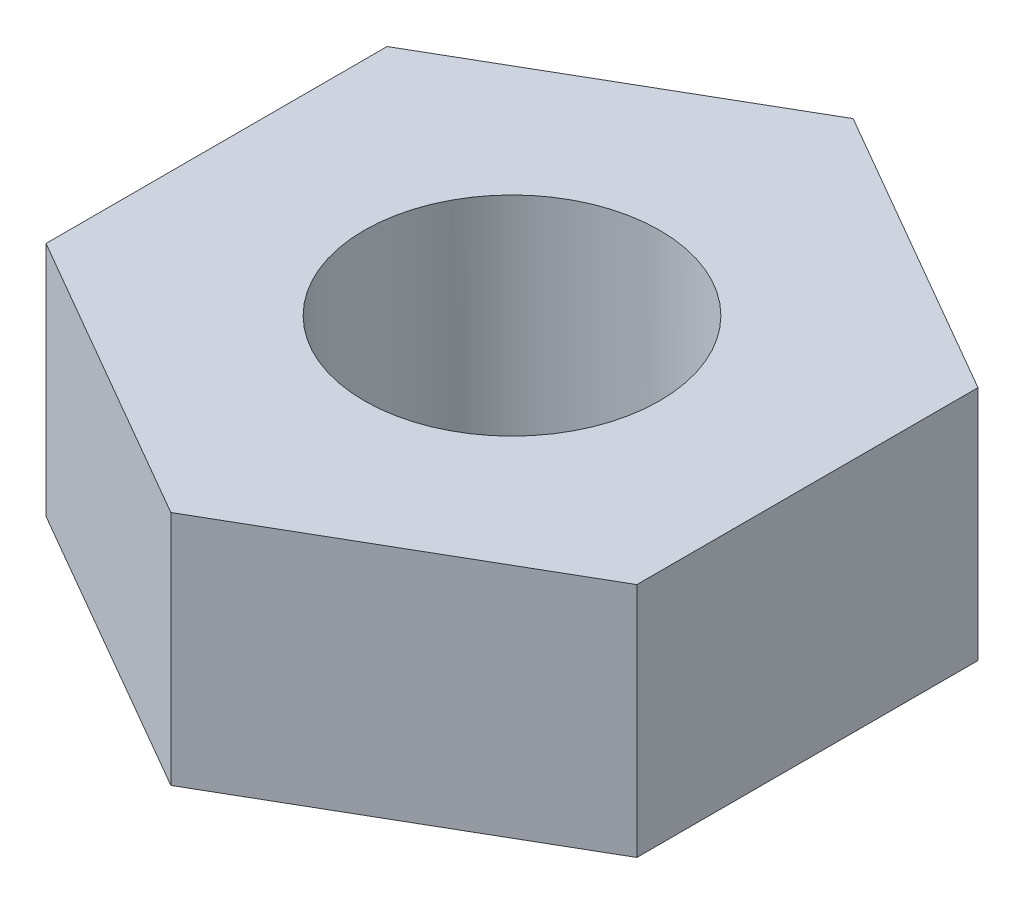
from build123d import *

# Parameters (mm, degrees)
BOSS_EXTRUDE1_DEPTH     = 1.6
CUT_EXTRUDE1_DEPTH      = 4.448671242
CUT_EXTRUDE1_DEPTH_BACK = 4.448671242
SKETCH2_R               = 1


with BuildPart() as part:
    # Sketch1 → Boss-Extrude1 (new body)
    with BuildSketch(Plane(origin=(0, 0, 0), x_dir=(1, 0, 0), z_dir=(0, 1, 0))):
        Polygon((2, -1.154700538), (0, -2.309401077), (-2, -1.154700538), (-2, 1.154700538), (0, 2.309401077), (2, 1.154700538), align=None)
    extrude(amount=-BOSS_EXTRUDE1_DEPTH)

    # Sketch2 → Cut-Extrude1 (cut, two sides: drawn at the far end of the back side and taken through both)
    with BuildSketch(Plane(origin=(0, 0, 0), x_dir=(1, 0, 0), z_dir=(0, 1, 0)).offset(-CUT_EXTRUDE1_DEPTH_BACK)):
        with Locations(Location((0, 0, 0), (0, 0, 270))):
            Circle(SKETCH2_R)
    extrude(amount=CUT_EXTRUDE1_DEPTH + CUT_EXTRUDE1_DEPTH_BACK, mode=Mode.SUBTRACT)


solid = part.part
